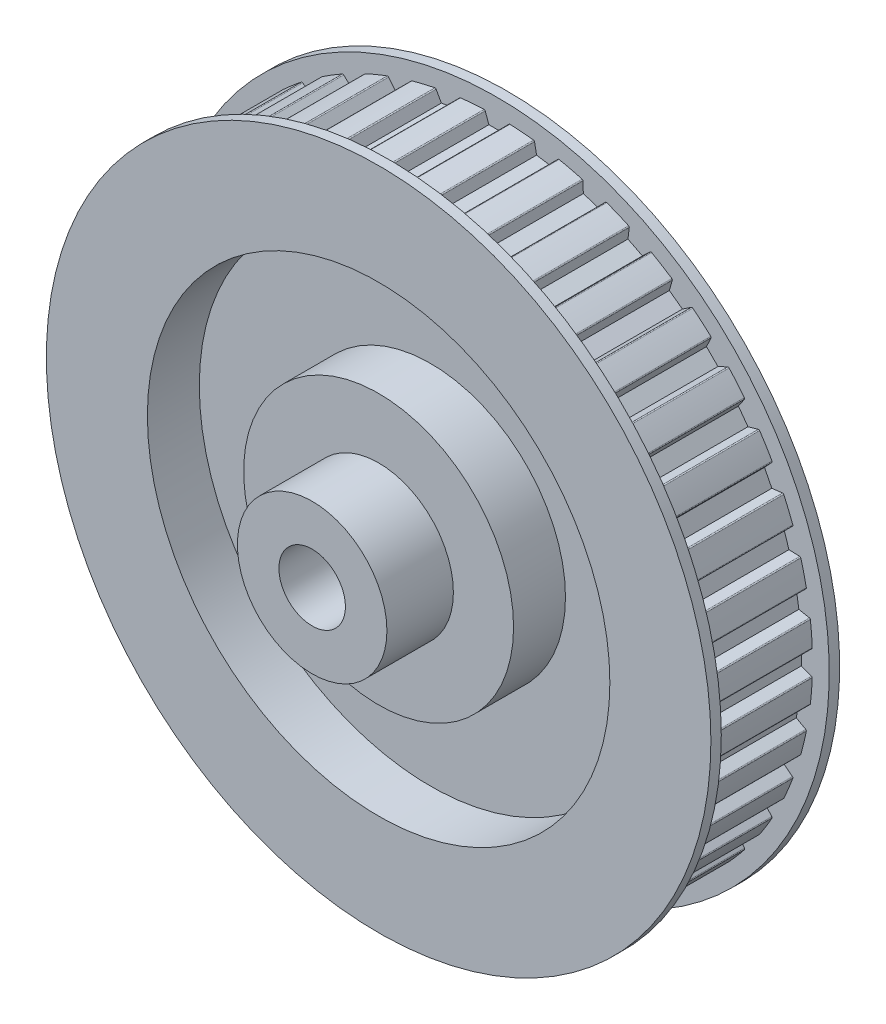
from build123d import *

# Parameters (mm, degrees)
SKETCH1_W           = 63.5
SKETCH1_H           = 1.984375
BOSS_EXTRUDE1_DEPTH = 20.6375
BOSS_EXTRUDE2_START = -1.984375
SKETCH3_R           = 63.5
BOSS_EXTRUDE2_DEPTH = 1.984375
HOLE1_D             = 88.382475
HOLE1_DEPTH         = 9.921875
HOLE2_D             = 88.382475
HOLE2_DEPTH         = 9.921875
SKETCH8_W           = 14.2875
SKETCH8_H           = 9.921875
HOLE3_D             = 12.7127
FILLET1_R           = 0.2286
CUT_EXTRUDE1_DEPTH  = 20.6502
CIRPATTERN2_COUNT   = 40


with BuildPart() as part:
    # Sketch1 → Revolve1 (revolve)
    with BuildSketch(Plane(origin=(0, 0, 0), x_dir=(1, 0, 0), z_dir=(0, 1, 0))):
        with Locations((31.75, -11.3109375)):
            Rectangle(SKETCH1_W, SKETCH1_H)
    revolve(axis=Axis((0, 0, 10.31875), (0, 0, 1)))

    # Sketch2 → Boss-Extrude1 (add)
    with BuildSketch(Plane(origin=(0, 0, 10.31875), x_dir=(-1, 0, 0), z_dir=(0, 0, -1))):
        with BuildLine():
            Line((20.814765597, -56.586407632), (19.445887203, -54.834323187))
            Line((19.445887203, -54.834323187), (16.498753271, -55.791905049))
            Line((16.498753271, -55.791905049), (16.421156785, -58.013977673))
            ThreePointArc((16.421156785, -58.013977673), (-4.730553873, -60.107386032), (-25.294370657, -54.730894462))
            Line((-25.294370657, -54.730894462), (-25.02340306, -52.524040475))
            Line((-25.02340306, -52.524040475), (-27.784454077, -51.117214714))
            Line((-27.784454077, -51.117214714), (-29.410565699, -52.633588333))
            ThreePointArc((-29.410565699, -52.633588333), (-42.633765935, -42.633765935), (-52.633588333, -29.410565699))
            Line((-52.633588333, -29.410565699), (-51.117214714, -27.784454077))
            Line((-51.117214714, -27.784454077), (-52.524040475, -25.02340306))
            Line((-52.524040475, -25.02340306), (-54.730894462, -25.294370657))
            ThreePointArc((-54.730894462, -25.294370657), (-60.107386032, -4.730553873), (-58.013977673, 16.421156785))
            Line((-58.013977673, 16.421156785), (-55.791905049, 16.498753271))
            Line((-55.791905049, 16.498753271), (-54.834323187, 19.445887203))
            Line((-54.834323187, 19.445887203), (-56.586407632, 20.814765597))
            ThreePointArc((-56.586407632, 20.814765597), (-48.778263896, 35.439483163), (-37.282180065, 47.384755409))
            Line((-37.282180065, 47.384755409), (-35.43887548, 46.141430767))
            Line((-35.43887548, 46.141430767), (-32.931893617, 47.962859707))
            Line((-32.931893617, 47.962859707), (-33.544753177, 50.100154988))
            ThreePointArc((-33.544753177, 50.100154988), (-14.075179684, 58.627342703), (7.143599533, 59.868564216))
            Line((7.143599533, 59.868564216), (7.56784942, 57.685987758))
            Line((7.56784942, 57.685987758), (10.62849805, 57.201228638))
            Line((10.62849805, 57.201228638), (11.706436886, 59.145881776))
            ThreePointArc((11.706436886, 59.145881776), (27.372562698, 53.721679115), (40.969152545, 44.235783426))
            Line((40.969152545, 44.235783426), (40.02949166, 42.220674153))
            Line((40.02949166, 42.220674153), (42.220674153, 40.02949166))
            Line((42.220674153, 40.02949166), (44.235783426, 40.969152545))
            ThreePointArc((44.235783426, 40.969152545), (53.721679115, 27.372562698), (59.145881776, 11.706436886))
            Line((59.145881776, 11.706436886), (57.201228638, 10.62849805))
            Line((57.201228638, 10.62849805), (57.685987758, 7.56784942))
            Line((57.685987758, 7.56784942), (59.868564216, 7.143599533))
            ThreePointArc((59.868564216, 7.143599533), (58.627342703, -14.075179684), (50.100154988, -33.544753177))
            Line((50.100154988, -33.544753177), (47.962859707, -32.931893617))
            Line((47.962859707, -32.931893617), (46.141430767, -35.43887548))
            Line((46.141430767, -35.43887548), (47.384755409, -37.282180065))
            ThreePointArc((47.384755409, -37.282180065), (35.439483163, -48.778263896), (20.814765597, -56.586407632))
        make_face()
    extrude(amount=BOSS_EXTRUDE1_DEPTH)

    # Sketch3 → Boss-Extrude2 (add)
    with BuildSketch(Plane.XY.offset(-10.31875).offset(BOSS_EXTRUDE2_START)):
        Circle(SKETCH3_R)
    extrude(amount=BOSS_EXTRUDE2_DEPTH)

    # Hole1
    with Locations(Plane(origin=(0, 0, -12.303125), x_dir=(-1, 0, 0), z_dir=(0, 0, -1))):
        with Locations((0, 0)):
            Hole(HOLE1_D / 2, depth=HOLE1_DEPTH)

    # Hole2
    with Locations(Plane.XY.offset(12.303125)):
        with Locations((0, 0)):
            Hole(HOLE2_D / 2, depth=HOLE2_DEPTH)

    # Sketch8 → Revolve2 (revolve)
    with BuildSketch(Plane(origin=(0, 0, 0), x_dir=(1, 0, 0), z_dir=(0, 1, 0)), mode=Mode.PRIVATE) as revolve2_sk:
        with Locations((7.14375, 7.3421875)):
            Rectangle(SKETCH8_W, SKETCH8_H)
    revolve(revolve2_sk.sketch.rotate(Axis((0, 0, -12.303125), (0, 0, 1)), 180), axis=Axis((0, 0, -12.303125), (0, 0, 1)))

    # Sketch9 → Revolve3 (revolve)
    with BuildSketch(Plane(origin=(0, 0, 0), x_dir=(1, 0, 0), z_dir=(0, 1, 0))):
        Polygon((25.7889375, -2.38125), (0, -2.38125), (0, -25.003125), (14.2875, -25.003125), (14.2875, -12.303125), (25.7889375, -12.303125), align=None)
    revolve(axis=Axis((0, 0, 2.38125), (0, 0, 1)))

    # Hole3 (through all)
    with Locations(Plane.XY.offset(25.003125)):
        with Locations((0, 0)):
            Hole(HOLE3_D / 2)

    # Fillet1
    fillet1_edges = [part.edges().sort_by_distance(p)[0] for p in [
        (-20.814765597, -56.586407632, 0),
        (-47.384755409, -37.282180065, 0),
        (-50.100154988, -33.544753177, 0),
        (-59.868564216, 7.143599533, 0),
        (-59.145881776, 11.706436886, 0),
        (-44.235783426, 40.969152545, 0),
        (-40.969152545, 44.235783426, 0),
        (-11.706436886, 59.145881776, 0),
        (-7.143599533, 59.868564216, 0),
        (33.544753177, 50.100154988, 0),
        (37.282180065, 47.384755409, 0),
        (56.586407632, 20.814765597, 0),
        (58.013977673, 16.421156785, 0),
        (54.730894462, -25.294370657, 0),
        (52.633588333, -29.410565699, 0),
        (29.410565699, -52.633588333, 0),
        (25.294370657, -54.730894462, 0),
        (-16.421156785, -58.013977673, 0),
    ]]
    fillet(fillet1_edges, radius=FILLET1_R)

    # Sketch12 → Cut-Extrude1 (cut)
    with BuildSketch(Plane.XY.offset(-10.31875)):
        with BuildLine():
            Line((35.43887548, 46.141430767), (37.143791211, 47.291410948))
            ThreePointArc((37.143791211, 47.291410948), (37.280307439, 47.330327929), (37.413474745, 47.281158013))
            ThreePointArc((37.413474745, 47.281158013), (35.439530543, 48.778329109), (33.405653911, 50.193010293))
            ThreePointArc((33.405653911, 50.193010293), (33.493568241, 50.081554999), (33.498741827, 49.939694342))
            Line((33.498741827, 49.939694342), (32.931893617, 47.962859707))
            Line((32.931893617, 47.962859707), (35.43887548, 46.141430767))
        make_face()
    cut_extrude1 = extrude(amount=CUT_EXTRUDE1_DEPTH, mode=Mode.SUBTRACT)

    # CirPattern2: Cut-Extrude1 ×40 about axis
    cirpattern2_axis = Axis((0, 0, 0), (0, 0, 1))
    for i in range(1, CIRPATTERN2_COUNT):
        add(cut_extrude1.rotate(cirpattern2_axis, i * 360 / CIRPATTERN2_COUNT), mode=Mode.SUBTRACT)


solid = part.part
